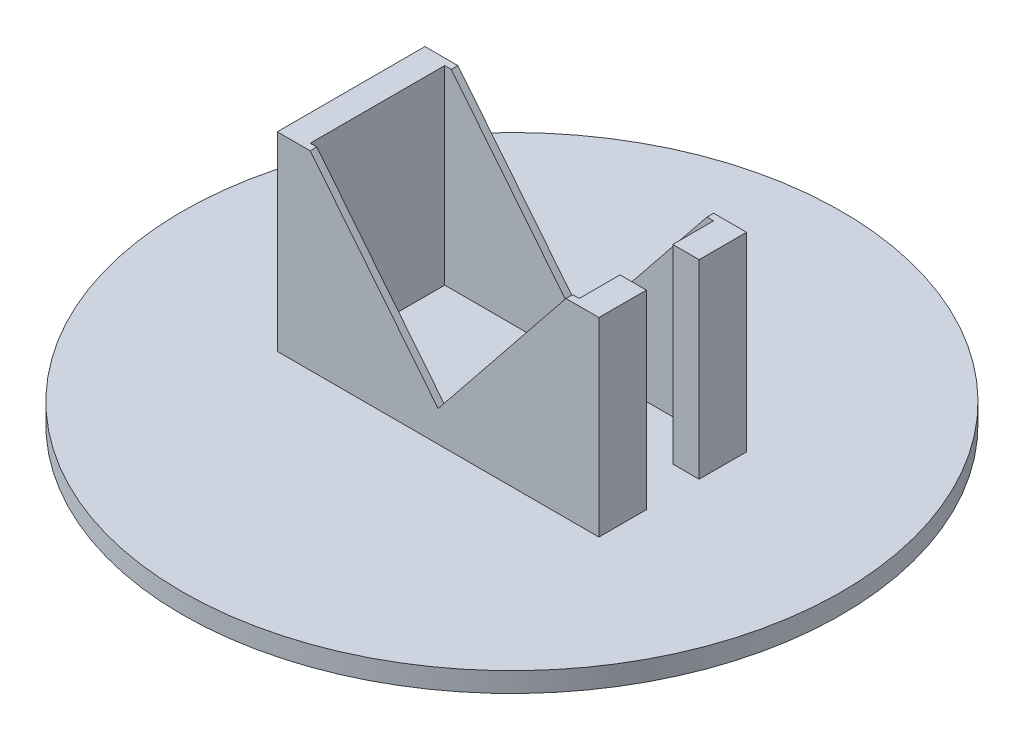
from build123d import *

# Parameters (mm, degrees)
SKIZZE1_R                       = 50
AUFSATZ_LINEAR_AUSTRAGEN1_DEPTH = 3
AUFSATZ_LINEAR_AUSTRAGEN2_DEPTH = 28.85
SCHNITT_LINEAR_AUSTRAGEN1_DEPTH = 28.85


with BuildPart() as part:
    # Skizze1 → Aufsatz-Linear austragen1 (new body)
    with BuildSketch(Plane(origin=(0, 0, 0), x_dir=(1, 0, 0), z_dir=(0, 1, 0))):
        with Locations(Location((0, 0, 0), (0, 0, 270))):
            Circle(SKIZZE1_R)
    extrude(amount=AUFSATZ_LINEAR_AUSTRAGEN1_DEPTH)

    # Skizze2 → Aufsatz-Linear austragen2 (add)
    with BuildSketch(Plane(origin=(0, 3, 0), x_dir=(1, 0, 0), z_dir=(0, 1, 0))):
        Polygon((20.4, 4), (24.4, 4), (24.4, 11.2), (-24.4, 11.2), (-24.4, -11.2), (24.4, -11.2), (24.4, -4), (20.4, -4), (20.4, -10.2), (-20.4, -10.2), (-20.4, 10.2), (20.4, 10.2), align=None)
    extrude(amount=AUFSATZ_LINEAR_AUSTRAGEN2_DEPTH)

    # Skizze3 → Schnitt-Linear austragen1 (cut)
    with BuildSketch(Plane.XY.offset(11.2)):
        Polygon((-19.4, 31.85), (0, 7.681220191), (19.4, 31.85), align=None)
    extrude(amount=-SCHNITT_LINEAR_AUSTRAGEN1_DEPTH, mode=Mode.SUBTRACT)


solid = part.part
